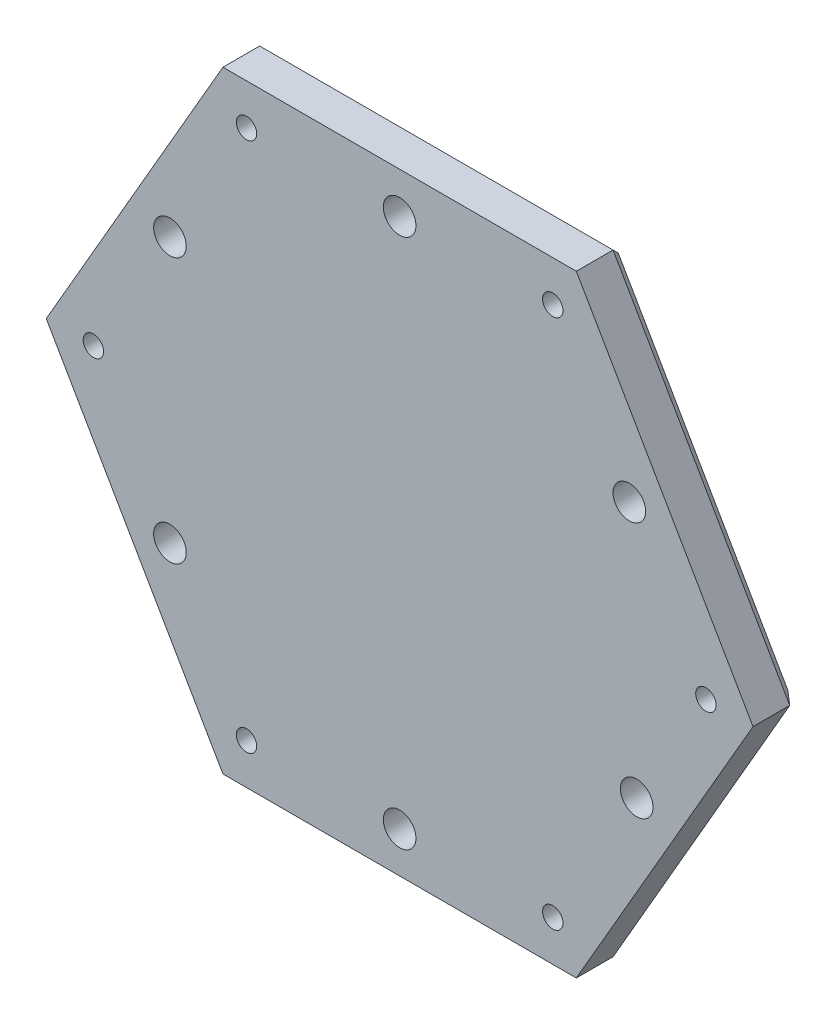
from build123d import *

# Parameters (mm, degrees)
BOSS_EXTRUDE1_DEPTH      = 6
CHAMFER1_SIZE            = 3
M6_TAPPED_HOLE1_D        = 5
F_8_0_8_DIAMETER_HOLE2_D = 8


with BuildPart() as part:
    # Sketch1 → Boss-Extrude1 (new, symmetric)
    with BuildSketch(Plane(origin=(0, 0, 0), x_dir=(0, 1, 0), z_dir=(0, 0, 1))):
        Polygon((0, -86.602540378), (75, -43.301270189), (75, 43.301270189), (0, 86.602540378), (-75, 43.301270189), (-75, -43.301270189), align=None)
    extrude(amount=BOSS_EXTRUDE1_DEPTH, both=True)

    # Chamfer1
    chamfer1_edges = [part.edges().sort_by_distance(p)[0] for p in [
        (0, -75, -6),
        (-64.951905284, -37.5, -6),
        (-64.951905284, 37.5, -6),
        (0, 75, -6),
        (64.951905284, 37.5, -6),
        (64.951905284, -37.5, -6),
    ]]
    chamfer(chamfer1_edges, length=CHAMFER1_SIZE)

    # M6 Tapped Hole1 (through all)
    with Locations(Plane(origin=(-37.527767497, 65, 6), x_dir=(1, 0, 0), z_dir=(0, 0, 1))):
        with Locations((0, 0), (75.055534994, 0), (112.583302492, -65), (75.055534994, -130), (0, -130), (-37.527767498, -65)):
            Hole(M6_TAPPED_HOLE1_D / 2)

    # Ø8.0 (8) Diameter Hole2 (through all)
    with Locations(Plane(origin=(-56.291651246, 32.5, 6), x_dir=(1, 0, 0), z_dir=(0, 0, 1))):
        with Locations((0, 0), (56.291651246, 32.5), (112.583302492, 0), (114.387986435, -61.874195719), (56.291651246, -97.5), (0, -65)):
            Hole(F_8_0_8_DIAMETER_HOLE2_D / 2)


solid = part.part
